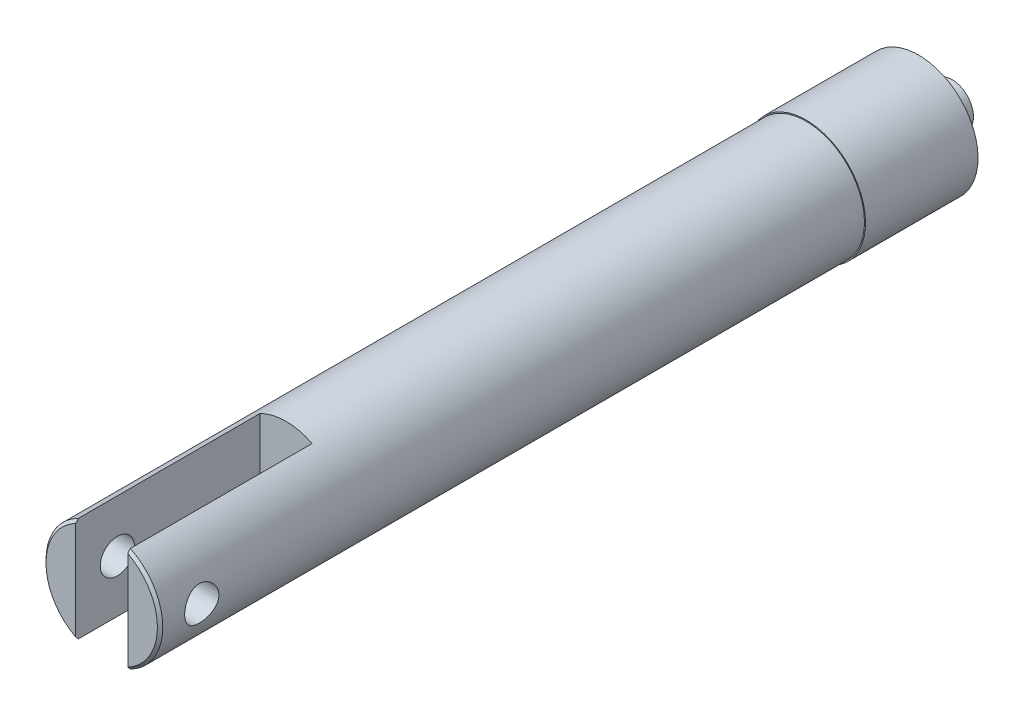
from build123d import *

# Parameters (mm, degrees)
CUT_EXTRUDE4_DEPTH      = 5.5499
CUT_EXTRUDE4_DEPTH_BACK = 5.5499
SKETCH18_W              = 4.953
SKETCH18_H              = 17.526
CUT_EXTRUDE5_DEPTH      = 53.127561136
CUT_EXTRUDE5_DEPTH_BACK = 53.127561136
SKETCH19_R              = 1.6256


with BuildPart() as part:
    # Sketch17 → Revolve2 (revolve)
    with BuildSketch(Plane(origin=(0, 0, 0), x_dir=(0, 0, -1), z_dir=(1, 0, 0)), mode=Mode.PRIVATE) as revolve2_sk:
        Polygon((-29.3116, 0), (51.5112, 0), (51.5112, 2.0447), (48.3362, 2.0447), (48.3362, 5.6515), (37.6428, 5.6515), (37.6428, 5.5499), (-29.0576, 5.5499), (-29.3116, 5.2959), align=None)
    revolve(revolve2_sk.sketch.rotate(Axis((0, 0, 29.3116), (0, 0, -1)), 180), axis=Axis((0, 0, 29.3116), (0, 0, -1)))

    # Sketch18 → Cut-Extrude4 (cut, two sides: drawn at the far end of the back side and taken through both)
    with BuildSketch(Plane(origin=(0, 0, 0), x_dir=(1, 0, 0), z_dir=(0, 1, 0)).offset(-CUT_EXTRUDE4_DEPTH_BACK)):
        with Locations((0, -20.5486)):
            Rectangle(SKETCH18_W, SKETCH18_H)
    extrude(amount=CUT_EXTRUDE4_DEPTH + CUT_EXTRUDE4_DEPTH_BACK, mode=Mode.SUBTRACT)

    # Sketch19 → Cut-Extrude5 (cut, two sides: drawn at the far end of the back side and taken through both)
    with BuildSketch(Plane(origin=(0, 0, 0), x_dir=(0, 0, -1), z_dir=(1, 0, 0)).offset(-CUT_EXTRUDE5_DEPTH_BACK)):
        with Locations((-25.3492, 0)):
            Circle(SKETCH19_R)
    extrude(amount=CUT_EXTRUDE5_DEPTH + CUT_EXTRUDE5_DEPTH_BACK, mode=Mode.SUBTRACT)


solid = part.part
